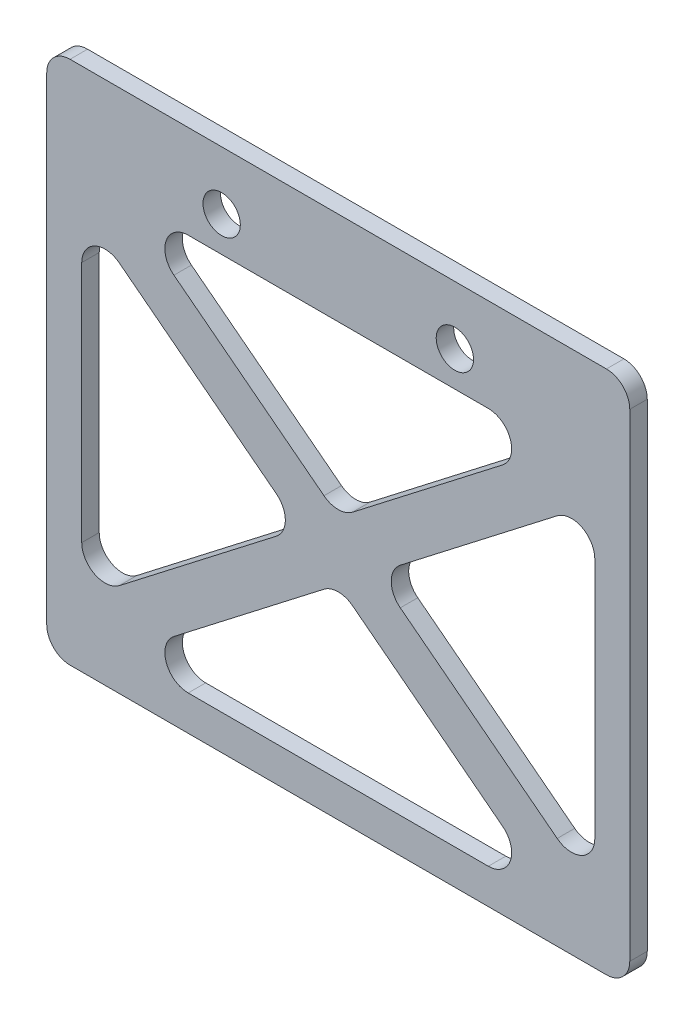
from build123d import *

# Parameters (mm, degrees)
SKETCH_1_W          = 50
SKETCH_1_H          = 45
EXTRUDE_1_DEPTH     = 1.5
SKETCH_2_R          = 1.6
CUT_EXTRUDE_1_DEPTH = 2
FILLET_1_R          = 2


with BuildPart() as part:
    # 草图1 → 凸台-拉伸1 (new body)
    with BuildSketch(Plane.XY):
        Rectangle(SKETCH_1_W, SKETCH_1_H)
    extrude(amount=EXTRUDE_1_DEPTH)

    # 草图2 → 切除-拉伸1 (cut)
    with BuildSketch(Plane(origin=(0, 0, 0), x_dir=(-1, 0, 0), z_dir=(0, 0, -1))):
        Polygon((18.72907323, 14.5), (-18.72907323, 14.5), (0, 0.027534323), align=None)
        Polygon((-3.27092677, -2.5), (-22, 11.972465677), (-22, -16.972465677), align=None)
        Polygon((18.72907323, -19.5), (0, -5.027534323), (-18.72907323, -19.5), align=None)
        Polygon((22, 11.972465677), (3.27092677, -2.5), (22, -16.972465677), align=None)
        with Locations((-10, 17.5)):
            Circle(SKETCH_2_R)
        with Locations((10, 17.5)):
            Circle(SKETCH_2_R)
    extrude(amount=-CUT_EXTRUDE_1_DEPTH, mode=Mode.SUBTRACT)

    # 圆角1
    fillet_1_edges = [part.edges().sort_by_distance(p)[0] for p in [
        (-3.27092677, -2.5, 0.75),
        (-22, 11.972465677, 0.75),
        (-22, -16.972465677, 0.75),
        (22, -16.972465677, 0.75),
        (22, 11.972465677, 0.75),
        (3.27092677, -2.5, 0.75),
        (18.72907323, -19.5, 0.75),
        (0, -5.027534323, 0.75),
        (-18.72907323, -19.5, 0.75),
        (0, 0.027534323, 0.75),
        (18.72907323, 14.5, 0.75),
        (-18.72907323, 14.5, 0.75),
        (25, -22.5, 0.75),
        (-25, -22.5, 0.75),
        (-25, 22.5, 0.75),
        (25, 22.5, 0.75),
    ]]
    fillet(fillet_1_edges, radius=FILLET_1_R)


solid = part.part
